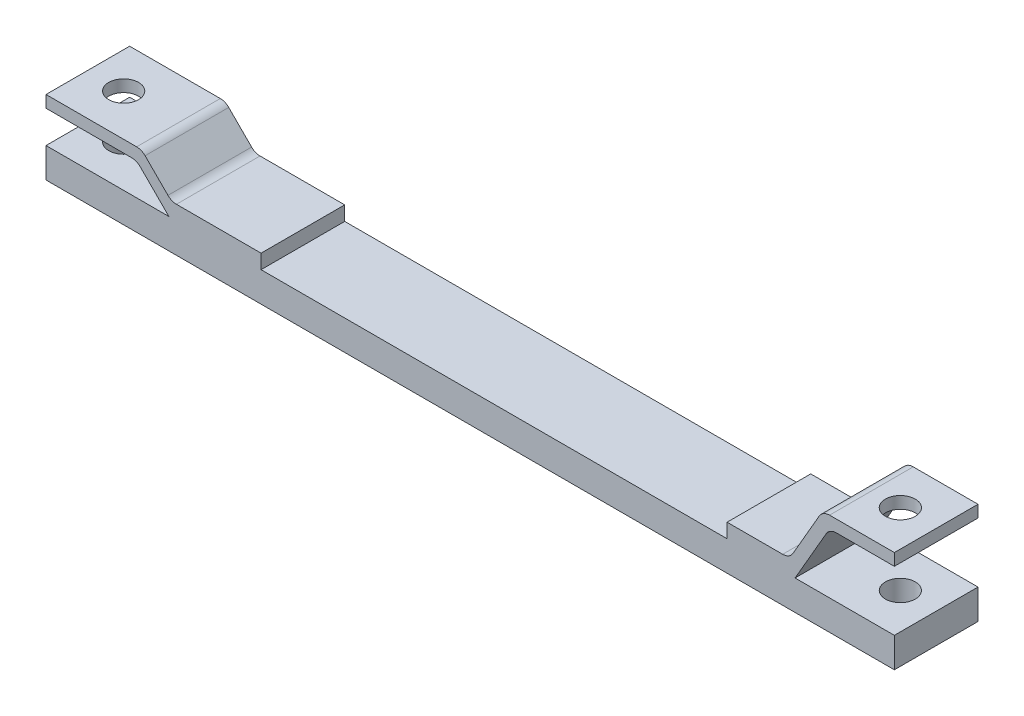
from build123d import *

# Parameters (mm, degrees)
SKETCH1_W           = 710
SKETCH1_H           = 25
BOSS_EXTRUDE1_DEPTH = 70
FILLET1_R           = 10
SKETCH2_R           = 12.5
CUT_EXTRUDE1_DEPTH  = 100


with BuildPart() as part:
    # Sketch1 → Boss-Extrude1 (new body)
    with BuildSketch(Plane.XY):
        Polygon((-254.142135624, 14.5), (-252.142135624, 12.5), (-175, 12.5), (-175, 24.5), (-250, 24.5), (-275, 49.5), (-355, 49.5), (-355, 39.5), (-279.142135624, 39.5), align=None)
        Rectangle(SKETCH1_W, SKETCH1_H)
        Polygon((215, 24.5), (215, 12.5), (271.905989232, 12.5), (273.060689771, 14.5), (300.773502692, 62.5), (355, 62.5), (355, 72.5), (295, 72.5), (267.287187079, 24.5), align=None)
    extrude(amount=BOSS_EXTRUDE1_DEPTH)

    # Fillet1
    fillet1_edges = [part.edges().sort_by_distance(p)[0] for p in [
        (-279.142135624, 39.5, 35),
        (-275, 49.5, 35),
        (-250, 24.5, 35),
        (267.287187079, 24.5, 35),
        (295, 72.5, 35),
        (300.773502692, 62.5, 35),
    ]]
    fillet(fillet1_edges, radius=FILLET1_R)

    # Sketch2 → Cut-Extrude1 (cut)
    with BuildSketch(Plane(origin=(0, 72.5, 0), x_dir=(1, 0, 0), z_dir=(0, 1, 0))):
        with Locations(Location((325, -35, 0), (0, 0, 180))):
            Circle(SKETCH2_R)
        with Locations(Location((-325, -35, 0), (0, 0, 180))):
            Circle(SKETCH2_R)
    extrude(amount=-CUT_EXTRUDE1_DEPTH, mode=Mode.SUBTRACT)


solid = part.part
